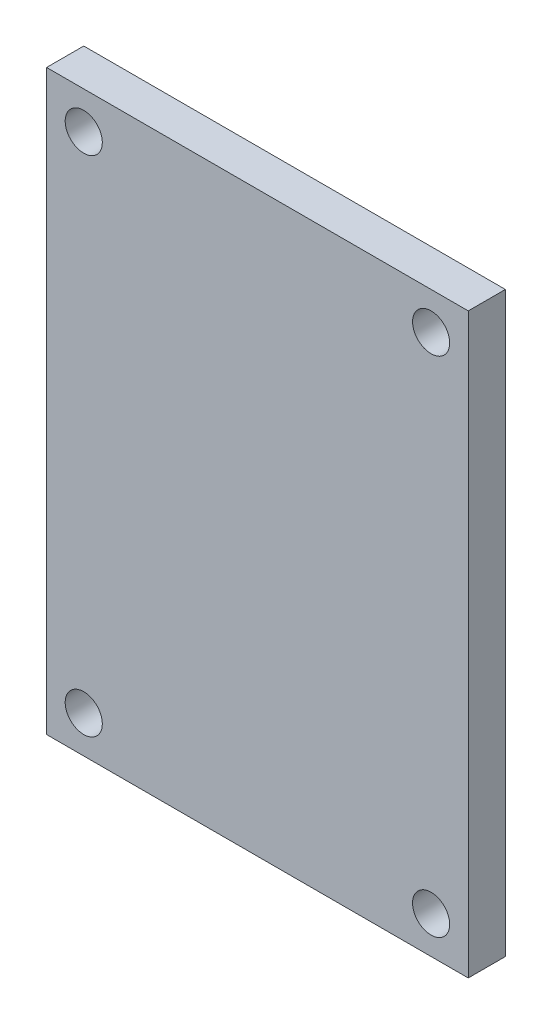
from build123d import *

# Parameters (mm, degrees)
SKETCH1_W           = 34.06
SKETCH1_H           = 46.67
BOSS_EXTRUDE1_DEPTH = 3
SKETCH2_R           = 1.5
CUT_EXTRUDE1_DEPTH  = 30.043813885


with BuildPart() as part:
    # Sketch1 → Boss-Extrude1 (new body)
    with BuildSketch(Plane.XY):
        Rectangle(SKETCH1_W, SKETCH1_H)
    extrude(amount=BOSS_EXTRUDE1_DEPTH)

    # Sketch2 → Cut-Extrude1 (cut, through all)
    with BuildSketch(Plane.XY.offset(3)):
        with Locations((-14.03, 20.335)):
            Circle(SKETCH2_R)
        with Locations((14.03, 20.335)):
            Circle(SKETCH2_R)
        with Locations((14.03, -20.335)):
            Circle(SKETCH2_R)
        with Locations((-14.03, -20.335)):
            Circle(SKETCH2_R)
    extrude(amount=-CUT_EXTRUDE1_DEPTH, mode=Mode.SUBTRACT)


solid = part.part
